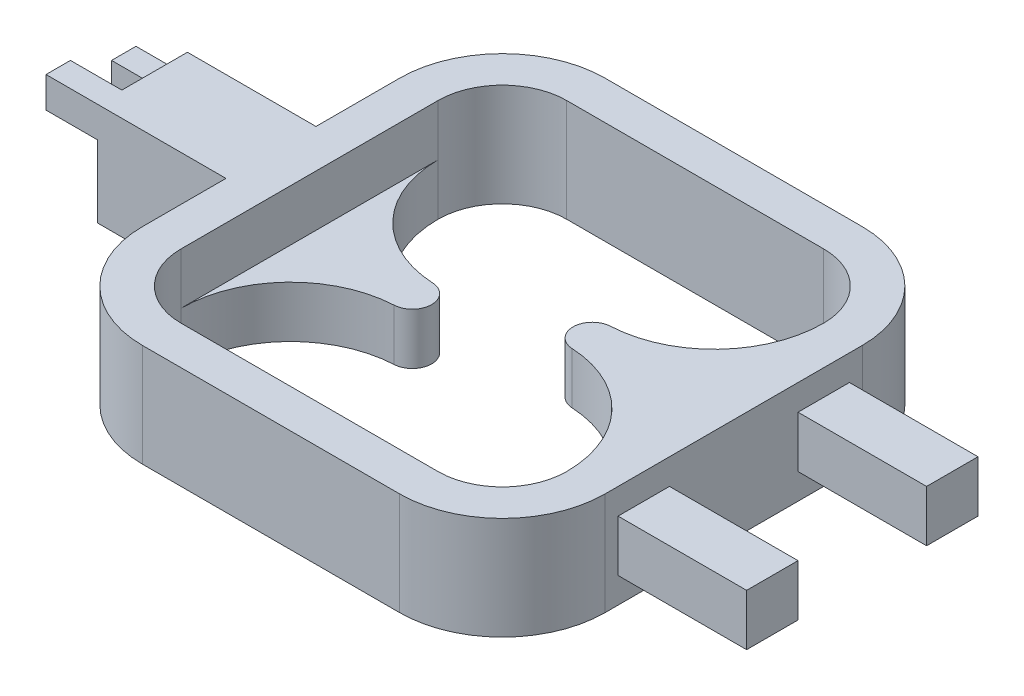
from build123d import *

# Parameters (mm, degrees)
BOSS_EXTRUDE1_DEPTH = 8
SKETCH2_W           = 1.9
SKETCH2_H           = 2.4
BOSS_EXTRUDE2_DEPTH = 4
SKETCH3_W           = 18
SKETCH3_H           = 2
CUT_EXTRUDE1_DEPTH  = 10
SKETCH4_W           = 9.5
SKETCH4_H           = 20
CUT_EXTRUDE2_DEPTH  = 4
SKETCH5_W           = 9.5
SKETCH5_H           = 20
CUT_EXTRUDE3_DEPTH  = 4


with BuildPart() as part:
    # Sketch1 → Boss-Extrude1 (new body)
    with BuildSketch(Plane(origin=(0, 0, 0), x_dir=(1, 0, 0), z_dir=(0, 1, 0))):
        with BuildLine():
            Line((-18, -10), (-18, -3.5))
            Line((-18, -3.5), (-28, -3.5))
            Line((-28, -3.5), (-28, 3.5))
            Line((-28, 3.5), (-18, 3.5))
            Line((-18, 3.5), (-18, 10))
            ThreePointArc((-18, 10), (-15.656854249, 15.656854249), (-10, 18))
            Line((-10, 18), (10, 18))
            ThreePointArc((10, 18), (15.656854249, 15.656854249), (18, 10))
            Line((18, 10), (18, 9))
            Line((18, 9), (28, 9))
            Line((28, 9), (28, 5))
            Line((28, 5), (18, 5))
            Line((18, 5), (18, -5))
            Line((18, -5), (28, -5))
            Line((28, -5), (28, -9))
            Line((28, -9), (18, -9))
            Line((18, -9), (18, -10))
            ThreePointArc((18, -10), (15.656854249, -15.656854249), (10, -18))
            Line((10, -18), (-10, -18))
            ThreePointArc((-10, -18), (-15.656854249, -15.656854249), (-18, -10))
        make_face()
        with BuildLine():
            Line((-10, -15), (10, -15))
            ThreePointArc((10, -15), (13.535533906, -13.535533906), (15, -10))
            ThreePointArc((15, -10), (12.658876757, -4.136567081), (6.923127464, -1.498028909))
            ThreePointArc((6.923127464, -1.498028909), (5.5, 0), (6.923127464, 1.498028909))
            ThreePointArc((6.923127464, 1.498028909), (12.658876757, 4.136567081), (15, 10))
            ThreePointArc((15, 10), (13.535533906, 13.535533906), (10, 15))
            Line((10, 15), (-10, 15))
            ThreePointArc((-10, 15), (-13.535533906, 13.535533906), (-15, 10))
            ThreePointArc((-15, 10), (-12.658876757, 4.136567081), (-6.923127464, 1.498028909))
            ThreePointArc((-6.923127464, 1.498028909), (-5.5, 0), (-6.923127464, -1.498028909))
            ThreePointArc((-6.923127464, -1.498028909), (-12.658876757, -4.136567081), (-15, -10))
            ThreePointArc((-15, -10), (-13.535533906, -13.535533906), (-10, -15))
        make_face(mode=Mode.SUBTRACT)
    extrude(amount=BOSS_EXTRUDE1_DEPTH)

    # Sketch2 → Boss-Extrude2 (add)
    with BuildSketch(Plane.ZY.offset(28)):
        with Locations((2.55, 6.8)):
            Rectangle(SKETCH2_W, SKETCH2_H)
        with Locations((-2.55, 5.2)):
            Rectangle(SKETCH2_W, SKETCH2_H)
    extrude(amount=BOSS_EXTRUDE2_DEPTH)

    # Sketch3 → Cut-Extrude1 (cut)
    with BuildSketch(Plane(origin=(28, 0, 0), x_dir=(0, 0, -1), z_dir=(1, 0, 0))):
        with Locations((0, 1)):
            Rectangle(SKETCH3_W, SKETCH3_H)
        with Locations((0, 7)):
            Rectangle(SKETCH3_W, SKETCH3_H)
    extrude(amount=-CUT_EXTRUDE1_DEPTH, mode=Mode.SUBTRACT)

    # Sketch4 → Cut-Extrude2 (cut)
    with BuildSketch(Plane.XZ):
        with Locations((10.25, 0)):
            Rectangle(SKETCH4_W, SKETCH4_H)
    extrude(amount=-CUT_EXTRUDE2_DEPTH, mode=Mode.SUBTRACT)

    # Sketch5 → Cut-Extrude3 (cut)
    with BuildSketch(Plane(origin=(0, 8, 0), x_dir=(1, 0, 0), z_dir=(0, 1, 0))):
        with Locations((-10.25, 0)):
            Rectangle(SKETCH5_W, SKETCH5_H)
    extrude(amount=-CUT_EXTRUDE3_DEPTH, mode=Mode.SUBTRACT)


solid = part.part
